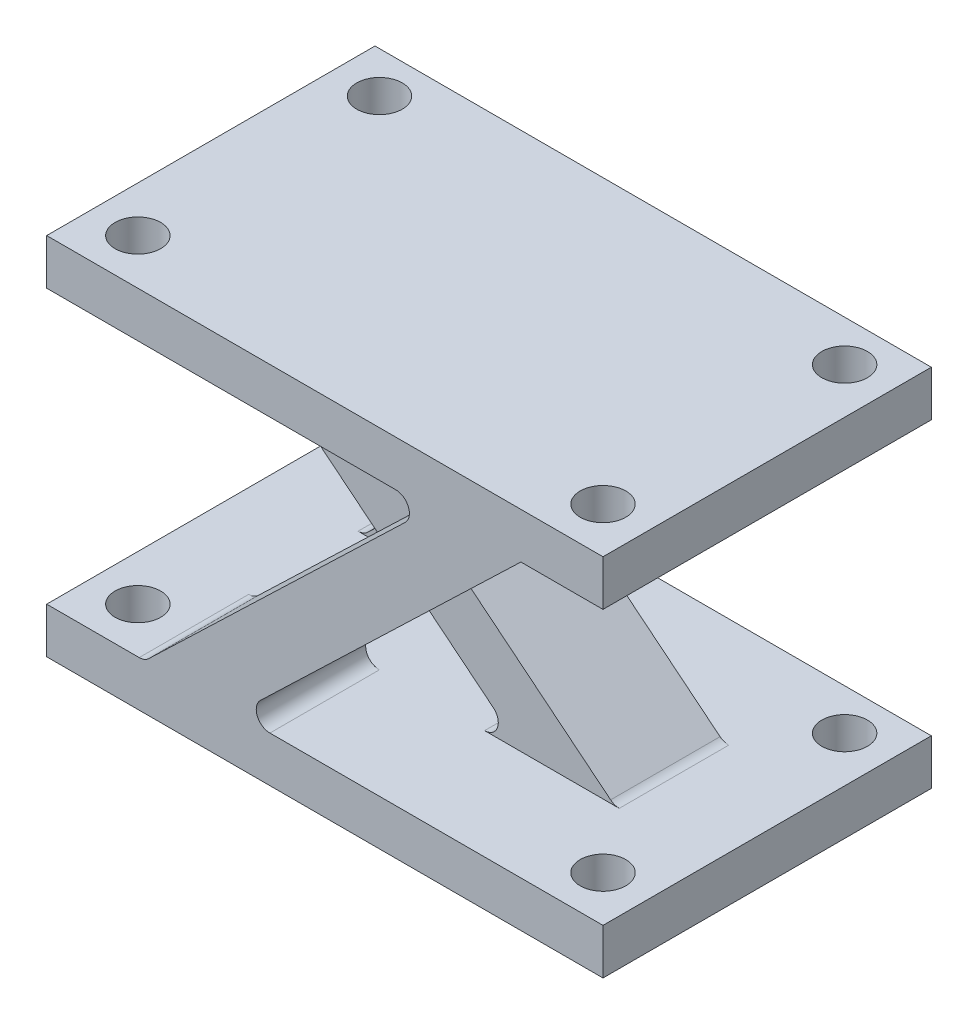
from build123d import *

# Parameters (mm, degrees)
SKETCH1_W           = 61
SKETCH1_H           = 36
SKETCH1_R           = 2.5
BOSS_EXTRUDE1_DEPTH = 5
BOSS_EXTRUDE3_START = -18
BOSS_EXTRUDE3_DEPTH = 6
BOSS_EXTRUDE2_DEPTH = 12
FILLET1_R           = 1.5
FILLET2_R           = 1.5
FILLET3_R           = 1.5
FILLET4_R           = 1.5
SKETCH5_W           = 61
SKETCH5_H           = 36
SKETCH5_R           = 2.5
BOSS_EXTRUDE4_DEPTH = 5
FILLET5_R           = 1.5
FILLET6_R           = 1.5
FILLET7_R           = 1.5


with BuildPart() as part:
    # Sketch1 → Boss-Extrude1 (new body)
    with BuildSketch(Plane(origin=(0, 0, 0), x_dir=(1, 0, 0), z_dir=(0, 1, 0))):
        Rectangle(SKETCH1_W, SKETCH1_H)
        with Locations(Location((-25.5, 13.49396263, 0), (0, 0, 270))):
            Circle(SKETCH1_R, mode=Mode.SUBTRACT)
        with Locations(Location((25.5, 13.49396263, 0), (0, 0, 270))):
            Circle(SKETCH1_R, mode=Mode.SUBTRACT)
        with Locations(Location((25.5, -13, 0), (0, 0, 270))):
            Circle(SKETCH1_R, mode=Mode.SUBTRACT)
        with Locations(Location((-25.5, -13, 0), (0, 0, 270))):
            Circle(SKETCH1_R, mode=Mode.SUBTRACT)
    extrude(amount=BOSS_EXTRUDE1_DEPTH)

    # Sketch4 → Boss-Extrude3 (add, symmetric)
    with BuildSketch(Plane.XY.offset(18).offset(BOSS_EXTRUDE3_START)):
        Polygon((19.75, 5), (-17.25, 35), (-27.25, 35), (9.75, 5), align=None)
    extrude(amount=BOSS_EXTRUDE3_DEPTH, both=True)

    # Sketch3 → Boss-Extrude2 (add)
    with BuildSketch(Plane.XY.offset(18)):
        Polygon((-19.75, 5), (11.5, 35), (21.5, 35), (-9.75, 5), align=None)
    boss_extrude2 = extrude(amount=-BOSS_EXTRUDE2_DEPTH)

    # Mirror1: Boss-Extrude2 across plane
    add(boss_extrude2.mirror(Plane.XY))

    # Fillet1
    fillet1_edges = [part.edges().sort_by_distance(p)[0] for p in [
        (-9.75, 5, 12),
    ]]
    fillet(fillet1_edges, radius=FILLET1_R)

    # Fillet2
    fillet2_edges = [part.edges().sort_by_distance(p)[0] for p in [
        (-9.75, 5, -12),
    ]]
    fillet(fillet2_edges, radius=FILLET2_R)

    # Fillet3
    fillet3_edges = [part.edges().sort_by_distance(p)[0] for p in [
        (9.75, 5, 0),
    ]]
    fillet(fillet3_edges, radius=FILLET3_R)

    # Fillet4
    fillet4_edges = [part.edges().sort_by_distance(p)[0] for p in [
        (19.75, 5, 0),
        (-19.75, 5, 12),
        (-19.75, 5, -12),
    ]]
    fillet(fillet4_edges, radius=FILLET4_R)

    # Sketch5 → Boss-Extrude4 (add)
    with BuildSketch(Plane(origin=(0, 35, 0), x_dir=(1, 0, 0), z_dir=(0, 1, 0))):
        Rectangle(SKETCH5_W, SKETCH5_H)
        with Locations(Location((-25.5, -13, 0), (0, 0, 270))):
            Circle(SKETCH5_R, mode=Mode.SUBTRACT)
        with Locations(Location((-25.5, 13.49396263, 0), (0, 0, 270))):
            Circle(SKETCH5_R, mode=Mode.SUBTRACT)
        with Locations(Location((25.5, 13.49396263, 0), (0, 0, 270))):
            Circle(SKETCH5_R, mode=Mode.SUBTRACT)
        with Locations(Location((25.5, -13, 0), (0, 0, 270))):
            Circle(SKETCH5_R, mode=Mode.SUBTRACT)
    extrude(amount=BOSS_EXTRUDE4_DEPTH)

    # Fillet5
    fillet5_edges = [part.edges().sort_by_distance(p)[0] for p in [
        (11.5, 35, 12),
    ]]
    fillet(fillet5_edges, radius=FILLET5_R)

    # Fillet6
    fillet6_edges = [part.edges().sort_by_distance(p)[0] for p in [
        (11.5, 35, -12),
    ]]
    fillet(fillet6_edges, radius=FILLET6_R)

    # Fillet7
    fillet7_edges = [part.edges().sort_by_distance(p)[0] for p in [
        (-17.25, 35, 0),
    ]]
    fillet(fillet7_edges, radius=FILLET7_R)


solid = part.part
